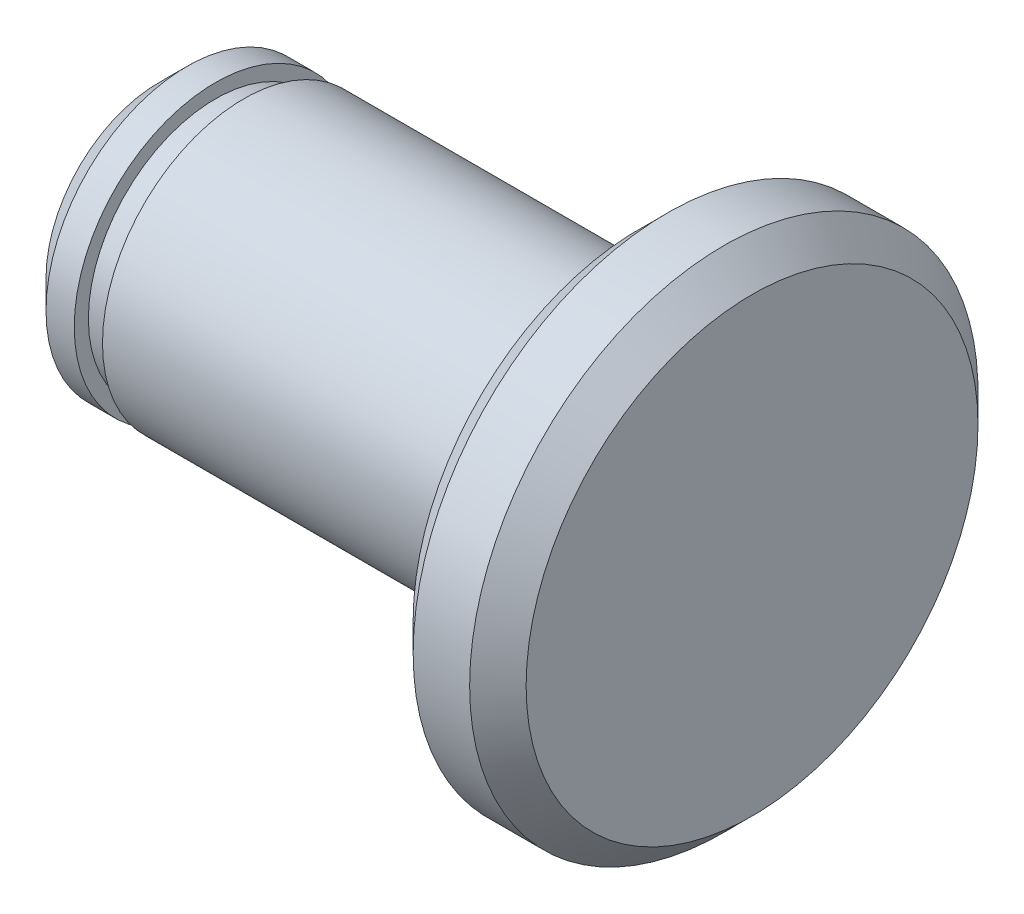
from build123d import *


with BuildPart() as part:
    # Sketch1 → Revolve1 (revolve)
    with BuildSketch(Plane(origin=(0, 0, 0), x_dir=(-1, 0, 0), z_dir=(0, 1, 0))):
        Polygon((-1, 9), (-3, 9), (-4, 8), (-4, 0), (17, 0), (17, 4), (16, 5), (15, 5), (15, 4.5), (14, 4.5), (14, 5), (0, 5), (0, 8), align=None)
    revolve(axis=Axis((-17, 0, 0), (1, 0, 0)))


solid = part.part
